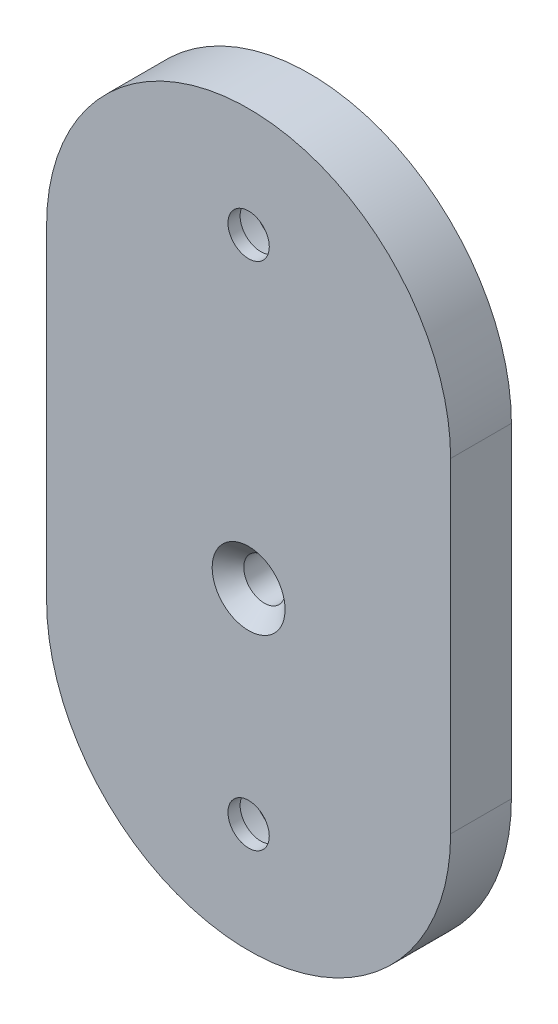
from build123d import *

# Parameters (mm, degrees)
SKETCH1_R           = 1.7
BOSS_EXTRUDE1_DEPTH = 5
SKETCH3_R           = 5
CUT_EXTRUDE1_DEPTH  = 4
CHAMFER1_SIZE       = 0.3


with BuildPart() as part:
    # Sketch1 → Boss-Extrude1 (new body)
    with BuildSketch(Plane.XY):
        with BuildLine():
            Line((-16.6225, -13.377), (-16.6225, 13.377))
            ThreePointArc((-16.6225, 13.377), (0, 29.9995), (16.6225, 13.377))
            Line((16.6225, 13.377), (16.6225, -13.377))
            ThreePointArc((16.6225, -13.377), (0, -29.9995), (-16.6225, -13.377))
        make_face()
        with Locations((0, -21)):
            Circle(SKETCH1_R, mode=Mode.SUBTRACT)
        with Locations((0, 21)):
            Circle(SKETCH1_R, mode=Mode.SUBTRACT)
    extrude(amount=BOSS_EXTRUDE1_DEPTH)

    # Sketch2 → Cut-Revolve1 (revolve, cut)
    with BuildSketch(Plane(origin=(0, 0, 0), x_dir=(0, 0, -1), z_dir=(1, 0, 0)), mode=Mode.PRIVATE) as cut_revolve1_sk:
        Polygon((0, -4.2), (-5, -4.2), (-5, -7.2), (-3.7, -5.9), (0, -5.9), align=None)
    revolve(cut_revolve1_sk.sketch.rotate(Axis((0, -4.2, 2.5), (0, 0, 1)), 180), axis=Axis((0, -4.2, 2.5), (0, 0, 1)), mode=Mode.SUBTRACT)

    # Sketch3 → Cut-Extrude1 (cut)
    with BuildSketch(Plane(origin=(0, 0, 0), x_dir=(-1, 0, 0), z_dir=(0, 0, -1))):
        with Locations((0, 21)):
            Circle(SKETCH3_R)
        with Locations((0, -21)):
            Circle(SKETCH3_R)
    extrude(amount=-CUT_EXTRUDE1_DEPTH, mode=Mode.SUBTRACT)

    # Chamfer1
    chamfer1_edges = [part.edges().sort_by_distance(p)[0] for p in [
        (5, 21, 0),
        (5, -21, 0),
    ]]
    chamfer(chamfer1_edges, length=CHAMFER1_SIZE)


solid = part.part
